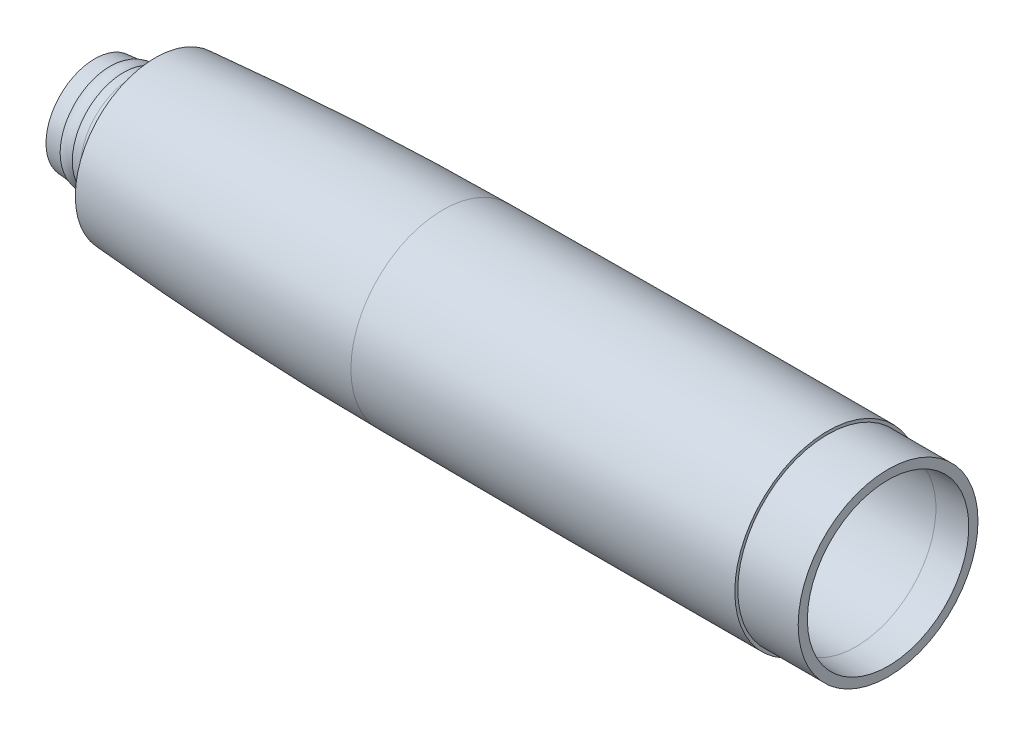
from build123d import *

# Parameters (mm, degrees)
RESSALTO_EXTRUS_O2_DEPTH = 0.5
PADR_OCIRCULAR2_COUNT    = 4


with BuildPart() as part:
    # Esboço2 → Revolução1 (revolve)
    with BuildSketch(Plane.XY, mode=Mode.PRIVATE) as revolu_o1_sk:
        with BuildLine():
            Line((1.399214201, 0), (1.399214201, 2.304315345))
            Line((1.399214201, 2.304315345), (1.399214201, 2.901511225))
            Line((1.399214201, 2.901511225), (0.599214201, 2.894529731))
            Line((0.599214201, 2.894529731), (0.599214201, 3.180078941))
            Line((0.599214201, 3.180078941), (0, 3.180078941))
            Line((0, 3.180078941), (0, 4.602814306))
            ThreePointArc((0, 4.602814306), (9.328506863, 5.085935569), (18.667553023, 5.277412145))
            ThreePointArc((18.667553023, 5.277412145), (19.431728753, 5.13021432), (20.166812297, 5.385721522))
            Line((20.166812297, 5.385721522), (26.389420386, 5.618552565))
            Line((26.389420386, 5.618552565), (48.188796476, 5.618552565))
            Line((48.188796476, 5.618552565), (50.450420766, 5.666829883))
            Line((50.450420766, 5.666829883), (50.450420766, 6.311661884))
            Line((50.450420766, 6.311661884), (46.208561923, 6.311661884))
            Line((46.208561923, 6.311661884), (46.208561923, 6.51843609))
            ThreePointArc((46.208561923, 6.51843609), (32.704390812, 6.517222328), (19.20033296, 6.461901061))
            ThreePointArc((19.20033296, 6.461901061), (9.097820391, 6.21965301), (-0.989579234, 5.616483747))
            Line((-0.989579234, 5.616483747), (-0.989579234, 3.654390161))
            Line((-0.989579234, 3.654390161), (-2.589579234, 3.654390161))
            Line((-2.589579234, 3.654390161), (-3.22157908, 3.599097338))
            ThreePointArc((-3.22157908, 3.599097338), (-3.699559677, 3.674166976), (-4.156835213, 3.51605314))
            Line((-4.156835213, 3.51605314), (-5.24262657, 3.422278594))
            Line((-5.24262657, 3.422278594), (-5.24262657, 2.554390153))
            Line((-5.24262657, 2.554390153), (0, 2.554390153))
            Line((0, 2.554390153), (0, 0))
            Line((0, 0), (1.399214201, 0))
        make_face()
    revolve(revolu_o1_sk.sketch.rotate(Axis((0, 0, 0), (1, 0, 0)), 90), axis=Axis((0, 0, 0), (1, 0, 0)))

    # Esboço4 → Ressalto-extrusão2 (add, symmetric)
    with BuildSketch(Plane.XY):
        with BuildLine():
            ThreePointArc((8.6, 5.058719828), (4.284103859, 4.860977318), (-0.028484319, 4.600891176))
            Line((-0.028484319, 4.600891176), (-0.028484319, 3.174502957))
            Line((-0.028484319, 3.174502957), (0.585276056, 3.174502957))
            Line((0.585276056, 3.174502957), (0.585276056, 2.883093491))
            Line((0.585276056, 2.883093491), (1.399214201, 2.883093491))
            Line((1.399214201, 2.883093491), (5.727507055, 3.217660171))
            ThreePointArc((5.727507055, 3.217660171), (5.987633251, 3.273250815), (6.223900968, 3.395453609))
            Line((6.223900968, 3.395453609), (8.6, 5.058719828))
        make_face()
    ressalto_extrus_o2 = extrude(amount=RESSALTO_EXTRUS_O2_DEPTH, both=True)

    # PadrãoCircular2: Ressalto-extrusão2 ×4 about axis
    padr_ocircular2_axis = Axis((0, 0, 0), (1, 0, 0))
    for i in range(1, PADR_OCIRCULAR2_COUNT):
        add(ressalto_extrus_o2.rotate(padr_ocircular2_axis, i * 360 / PADR_OCIRCULAR2_COUNT))


solid = part.part
